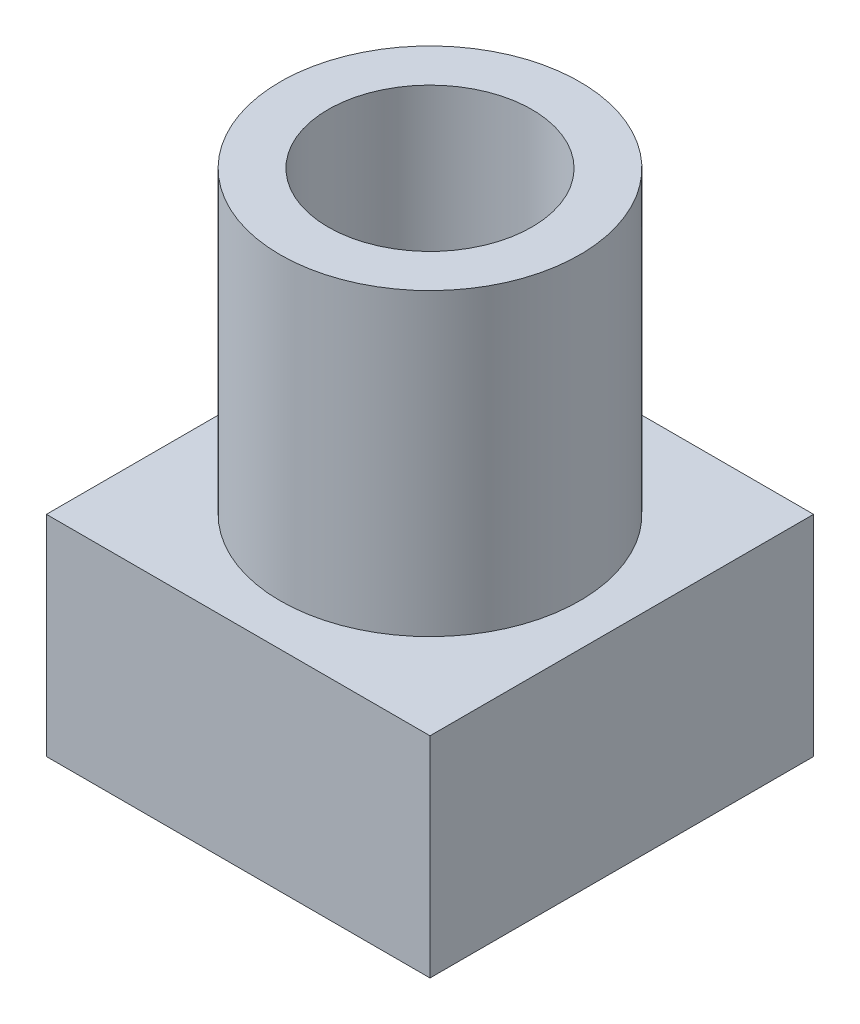
from build123d import *

# Parameters (mm, degrees)
SKETCH1_W           = 8.128
SKETCH1_H           = 8.128
BOSS_EXTRUDE1_DEPTH = 4.445
SKETCH2_W           = 6.35
SKETCH2_H           = 6.35
CUT_EXTRUDE1_DEPTH  = 4.064
SKETCH3_R           = 2.159
CUT_EXTRUDE2_DEPTH  = 8.265687648
BOSS_EXTRUDE2_START = 6.35
SKETCH4_R           = 3.175
SKETCH4_R_2         = 2.159
BOSS_EXTRUDE2_DEPTH = 6.35


with BuildPart() as part:
    # Sketch1 → Boss-Extrude1 (new body)
    with BuildSketch(Plane(origin=(0, 0, 0), x_dir=(1, 0, 0), z_dir=(0, 1, 0))):
        Rectangle(SKETCH1_W, SKETCH1_H)
    extrude(amount=-BOSS_EXTRUDE1_DEPTH)

    # Sketch2 → Cut-Extrude1 (cut)
    with BuildSketch(Plane.XZ.offset(4.445)):
        Rectangle(SKETCH2_W, SKETCH2_H)
    extrude(amount=-CUT_EXTRUDE1_DEPTH, mode=Mode.SUBTRACT)

    # Sketch3 → Cut-Extrude2 (cut, through all)
    with BuildSketch(Plane(origin=(0, 0, 0), x_dir=(1, 0, 0), z_dir=(0, 1, 0))):
        Circle(SKETCH3_R)
    extrude(amount=-CUT_EXTRUDE2_DEPTH, mode=Mode.SUBTRACT)

    # Sketch4 → Boss-Extrude2 (add)
    with BuildSketch(Plane(origin=(0, 0, 0), x_dir=(1, 0, 0), z_dir=(0, 1, 0)).offset(BOSS_EXTRUDE2_START)):
        Circle(SKETCH4_R)
        Circle(SKETCH4_R_2, mode=Mode.SUBTRACT)
    extrude(amount=-BOSS_EXTRUDE2_DEPTH)


solid = part.part
